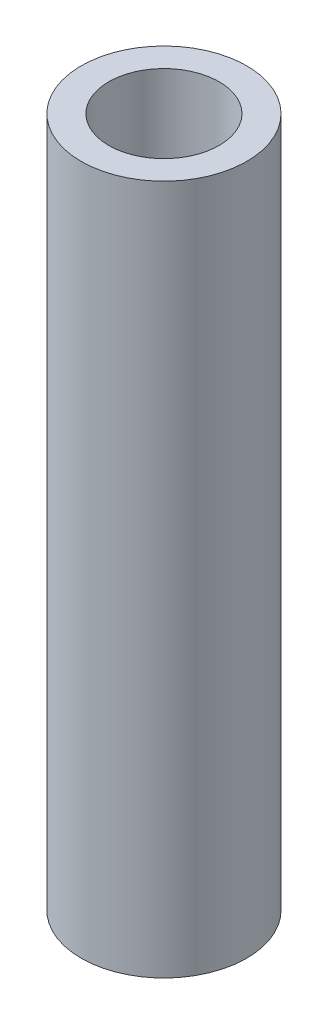
from build123d import *

# Parameters (mm, degrees)
SKICA1_W                 = 2
SKICA1_H                 = 25
SKICA2_R                 = 2
ODEBRAT_VYSUNUT_M1_DEPTH = 10


with BuildPart() as part:
    # Skica1 → Rotovat1 (revolve)
    with BuildSketch(Plane(origin=(0, 0, 0), x_dir=(0, 0, -1), z_dir=(1, 0, 0)), mode=Mode.PRIVATE) as rotovat1_sk:
        with Locations((2, 0.968340643)):
            Rectangle(SKICA1_W, SKICA1_H)
    revolve(rotovat1_sk.sketch.rotate(Axis((0, 13.468340643, 0), (0, -1, 0)), 180), axis=Axis((0, 13.468340643, 0), (0, -1, 0)))

    # Skica2 → Odebrat vysunutím1 (cut)
    with BuildSketch(Plane(origin=(0, 13.468340643, 0), x_dir=(1, 0, 0), z_dir=(0, 1, 0))):
        with Locations(Location((0, 0, 0), (0, 0, 270))):
            Circle(SKICA2_R)
    extrude(amount=-ODEBRAT_VYSUNUT_M1_DEPTH, mode=Mode.SUBTRACT)


solid = part.part
